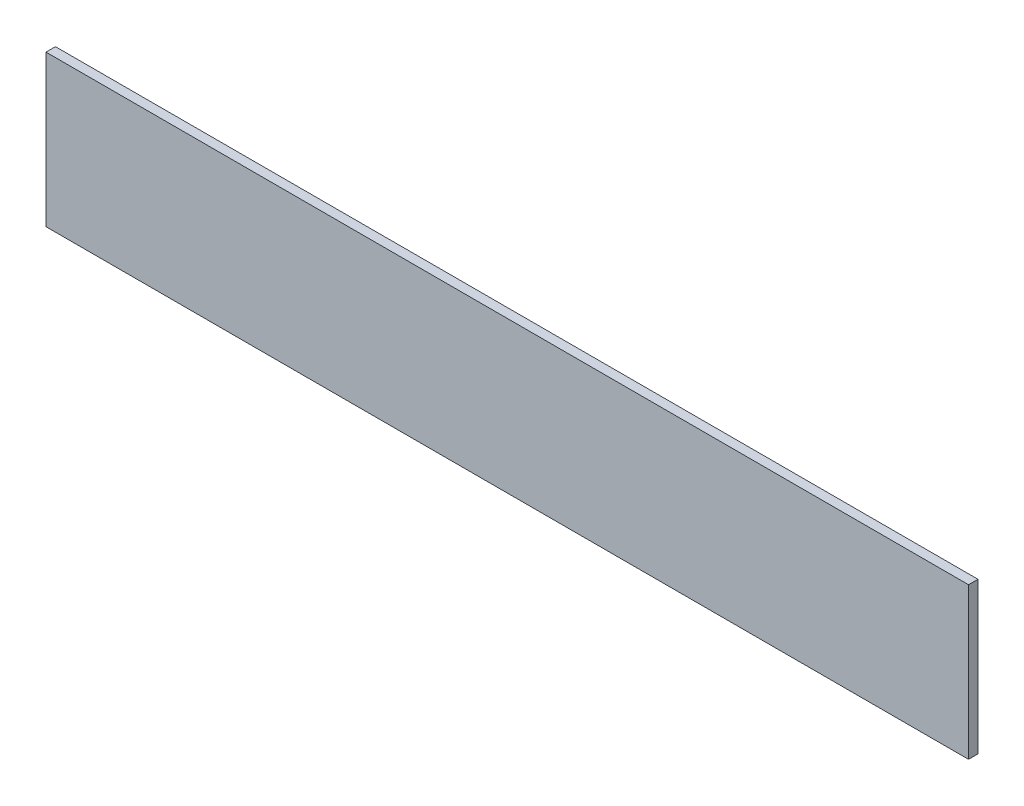
from build123d import *

# Parameters (mm, degrees)
SKETCH1_W           = 619.76
SKETCH1_H           = 101.6
BOSS_EXTRUDE1_DEPTH = 6.35


with BuildPart() as part:
    # Sketch1 → Boss-Extrude1 (new body)
    with BuildSketch(Plane.XY):
        with Locations((309.88, 50.8)):
            Rectangle(SKETCH1_W, SKETCH1_H)
    extrude(amount=BOSS_EXTRUDE1_DEPTH)


solid = part.part
